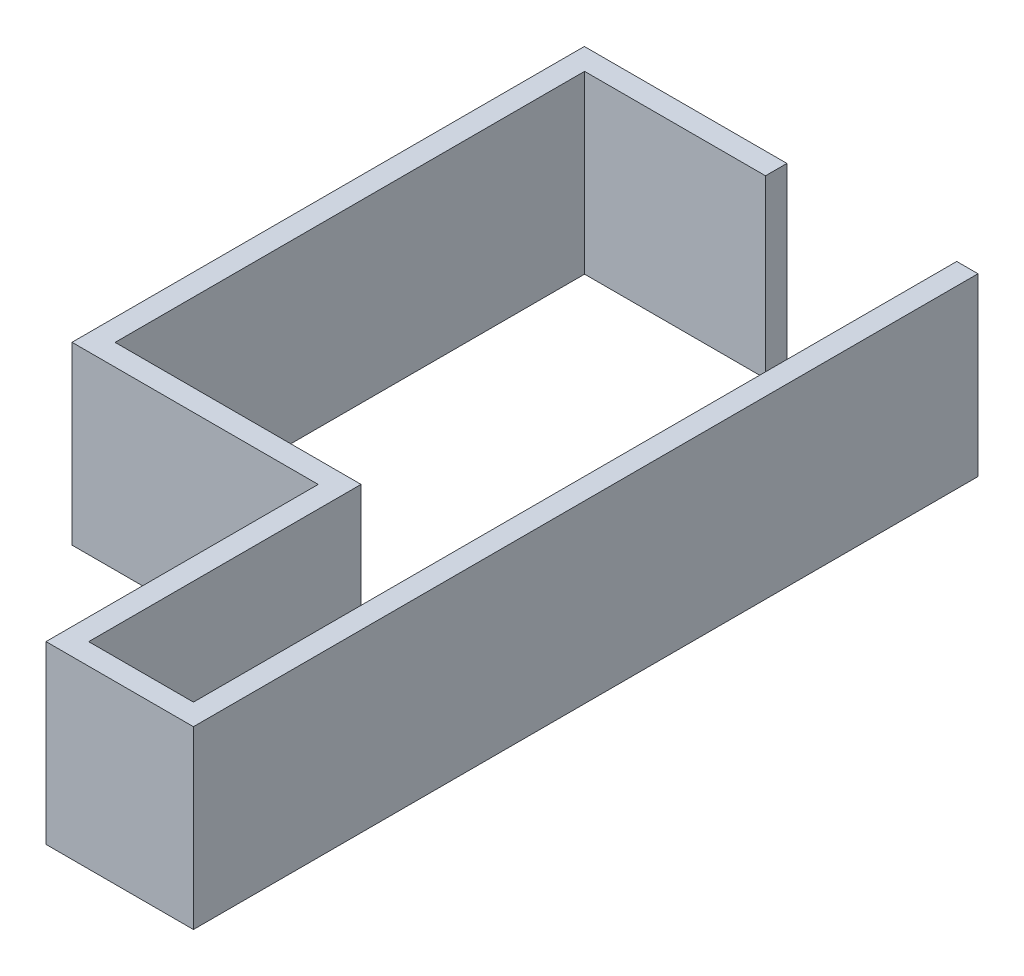
from build123d import *

# Parameters (mm, degrees)
BOSS_EXTRUDE1_DEPTH = 20.5


with BuildPart() as part:
    # Sketch1 → Boss-Extrude1 (new body)
    with BuildSketch(Plane(origin=(0, 0, 0), x_dir=(1, 0, 0), z_dir=(0, 1, 0))):
        Polygon((-17, 27.4), (-6.25, 27.4), (4.111165018, 27.4), (4.111165018, 29.9), (-6.25, 29.9), (-17.02688972, 29.9), (-19.526359915, 29.9), (-19.526359915, -27.387369428), (-19.526359915, -29.89147158), (9.205285723, -29.89147158), (9.205285723, -59.17239088), (9.205285723, -61.656459446), (23.92858304, -61.656459446), (26.410229248, -61.656459446), (26.410229248, 29.9), (23.92858304, 29.9), (23.92858304, 27.4), (23.92858304, -59.17239088), (11.703264231, -59.17239088), (11.703264231, -27.387369428), (-17, -27.387369428), (-17, 27.111876572), align=None)
    extrude(amount=BOSS_EXTRUDE1_DEPTH)


solid = part.part
